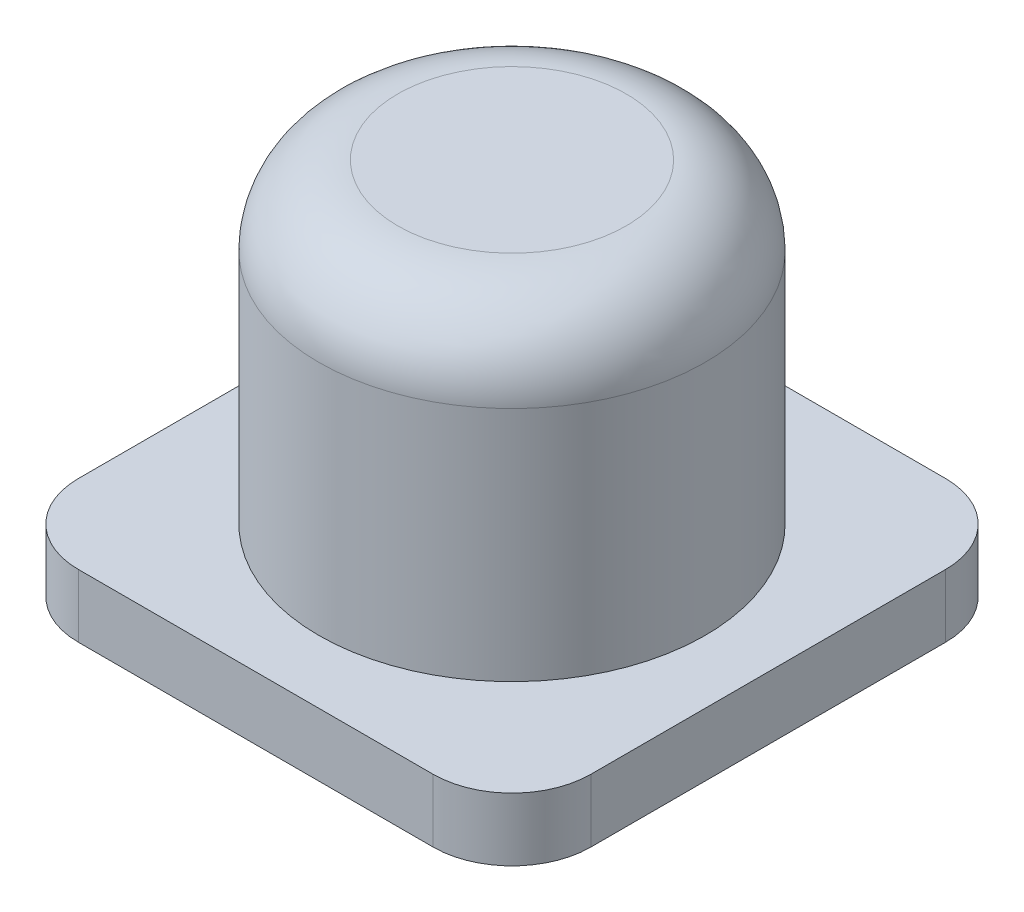
from build123d import *

# Parameters (mm, degrees)
SKETCH1_W           = 3.25
SKETCH1_H           = 3.25
BOSS_EXTRUDE1_DEPTH = 0.4
SKETCH2_R           = 1.225
BOSS_EXTRUDE2_DEPTH = 2
FILLET1_R           = 0.5
FILLET2_R           = 0.5


with BuildPart() as part:
    # Sketch1 → Boss-Extrude1 (new body)
    with BuildSketch(Plane(origin=(0, 0, 0), x_dir=(1, 0, 0), z_dir=(0, 1, 0))):
        Rectangle(SKETCH1_W, SKETCH1_H)
    extrude(amount=BOSS_EXTRUDE1_DEPTH)

    # Sketch2 → Boss-Extrude2 (add)
    with BuildSketch(Plane(origin=(0, 0.4, 0), x_dir=(1, 0, 0), z_dir=(0, 1, 0))):
        with Locations(Location((0, 0, 0), (0, 0, 270))):
            Circle(SKETCH2_R)
    extrude(amount=BOSS_EXTRUDE2_DEPTH)

    # Fillet1
    fillet1_edges = [part.edges().sort_by_distance(p)[0] for p in [
        (0, 2.4, -1.225),
    ]]
    fillet(fillet1_edges, radius=FILLET1_R)

    # Fillet2
    fillet2_edges = [part.edges().sort_by_distance(p)[0] for p in [
        (1.625, 0.2, 1.625),
        (-1.625, 0.2, 1.625),
        (-1.625, 0.2, -1.625),
        (1.625, 0.2, -1.625),
    ]]
    fillet(fillet2_edges, radius=FILLET2_R)


solid = part.part
